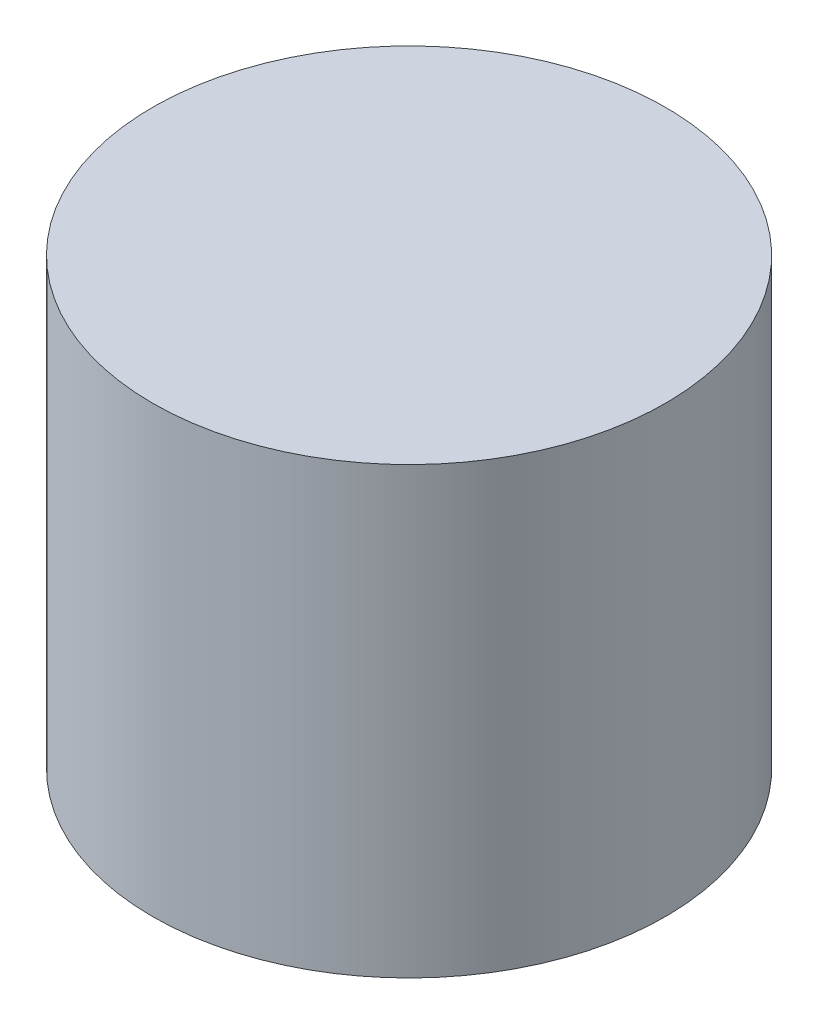
from build123d import *

# Parameters (mm, degrees)
SKETCH1_R           = 6.095
BOSS_EXTRUDE1_DEPTH = 10.57


with BuildPart() as part:
    # Sketch1 → Boss-Extrude1 (new body)
    with BuildSketch(Plane(origin=(0, 0, 0), x_dir=(1, 0, 0), z_dir=(0, 1, 0))):
        with Locations(Location((0, 0, 0), (0, 0, 270))):
            Circle(SKETCH1_R)
    extrude(amount=BOSS_EXTRUDE1_DEPTH)


solid = part.part
